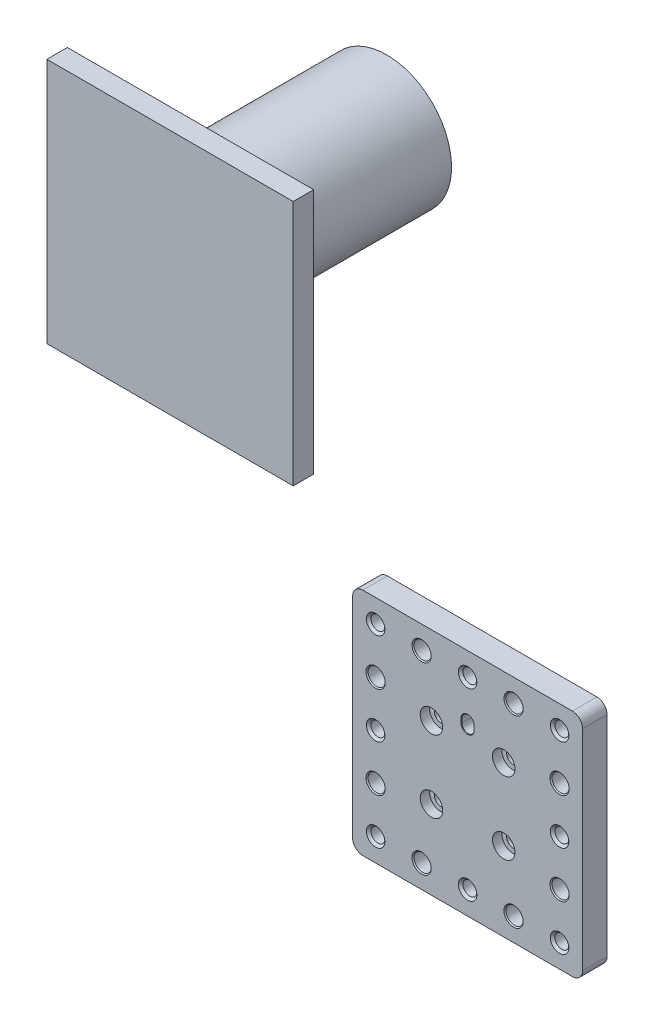
from build123d import *

# Parameters (mm, degrees)
SKETCH1_W                               = 112.5
SKETCH1_H                               = 112.5
BOSS_EXTRUDE1_DEPTH                     = 12
FILLET1_R                               = 5
SKETCH3_W                               = 31.7
SKETCH3_H                               = 4
CUT_EXTRUDE1_DEPTH                      = 81.449518333
CHAMFER3_SIZE                           = 0.25
CBORE_FOR_M6_HEX_HEAD_BOLT1_D           = 6.4
CBORE_FOR_M6_HEX_HEAD_BOLT1_CBORE_D     = 11
CBORE_FOR_M6_HEX_HEAD_BOLT1_CBORE_DEPTH = 4.6
F_6_8_6_8_DIAMETER_HOLE1_D              = 6.8
F_6_8_6_8_DIAMETER_HOLE2_D              = 6.8
CHAMFER1_SIZE                           = 1.125
CBORE_FOR_M8_HEX_HEAD_BOLT1_D           = 8.4
CBORE_FOR_M8_HEX_HEAD_BOLT1_CBORE_D     = 15
CBORE_FOR_M8_HEX_HEAD_BOLT1_CBORE_DEPTH = 5.6
CHAMFER2_SIZE                           = 0.5
SKETCH13_W                              = 120.5
SKETCH13_H                              = 120.5
BOSS_EXTRUDE5_DEPTH                     = 10
SKETCH20_R                              = 31.7
BOSS_EXTRUDE6_DEPTH                     = 100


with BuildPart() as part:
    # Sketch1 → Boss-Extrude1 (new body)
    with BuildSketch(Plane.XY.offset(12)):
        Rectangle(SKETCH1_W, SKETCH1_H)
    extrude(amount=-BOSS_EXTRUDE1_DEPTH)

    # Fillet1
    fillet1_edges = [part.edges().sort_by_distance(p)[0] for p in [
        (-56.25, 56.25, 6),
        (56.25, 56.25, 6),
        (56.25, -56.25, 6),
        (-56.25, -56.25, 6),
    ]]
    fillet(fillet1_edges, radius=FILLET1_R)

    # Sketch3 → Cut-Revolve1 (revolve, cut)
    with BuildSketch(Plane(origin=(0, 0, 0), x_dir=(1, 0, 0), z_dir=(0, 1, 0))):
        with Locations((-15.85, -2)):
            Rectangle(SKETCH3_W, SKETCH3_H)
    revolve(axis=Axis((0, 0, 4), (0, 0, -1)), mode=Mode.SUBTRACT)

    # Sketch2 → Cut-Extrude1 (cut, through all)
    with BuildSketch(Plane(origin=(0, 0, 0), x_dir=(-1, 0, 0), z_dir=(0, 0, -1))):
        with BuildLine():
            Line((3, 26), (3, 24))
            ThreePointArc((3, 24), (0, 21), (-3, 24))
            Line((-3, 24), (-3, 26))
            ThreePointArc((-3, 26), (0, 29), (3, 26))
        make_face()
    extrude(amount=-CUT_EXTRUDE1_DEPTH, mode=Mode.SUBTRACT)

    # Chamfer3
    chamfer3_edges = [part.edges().sort_by_distance(p)[0] for p in [
        (3, 25, 4),
        (0, 21, 4),
        (-3, 25, 4),
        (0, 29, 4),
        (0, 29, 12),
        (-3, 25, 12),
        (0, 21, 12),
        (3, 25, 12),
    ]]
    chamfer(chamfer3_edges, length=CHAMFER3_SIZE)

    # CBORE for M6 Hex Head Bolt1 (through all)
    with Locations(Plane.XY.offset(12)):
        with Locations((-17.67766953, -17.67766953), (17.67766953, -17.67766953), (17.67766953, 17.67766953), (-17.67766953, 17.67766953)):
            CounterBoreHole(CBORE_FOR_M6_HEX_HEAD_BOLT1_D / 2, CBORE_FOR_M6_HEX_HEAD_BOLT1_CBORE_D / 2, CBORE_FOR_M6_HEX_HEAD_BOLT1_CBORE_DEPTH)

    # Ø6.8 (6.8) Diameter Hole1 (through all)
    with Locations(Plane.XY.offset(12)):
        with Locations((-45, 0), (-45, 45), (0, -45), (45, -45), (-45, -45)):
            Hole(F_6_8_6_8_DIAMETER_HOLE1_D / 2)

    # Ø6.8 (6.8) Diameter Hole2 (through all)
    with Locations(Plane(origin=(0, 0, 0), x_dir=(-1, 0, 0), z_dir=(0, 0, -1))):
        with Locations((-45, 0), (0, 45), (-45, 45)):
            Hole(F_6_8_6_8_DIAMETER_HOLE2_D / 2)

    # Chamfer1
    chamfer1_edges = [part.edges().sort_by_distance(p)[0] for p in [
        (-41.6, -45, 12),
        (-41.6, -45, 0),
        (48.4, -45, 12),
        (48.4, -45, 0),
        (3.4, -45, 12),
        (3.4, -45, 0),
        (-41.6, 45, 12),
        (-41.6, 45, 0),
        (-41.6, 0, 12),
        (-41.6, 0, 0),
        (41.6, 45, 0),
        (41.6, 45, 12),
        (-3.4, 45, 0),
        (-3.4, 45, 12),
        (41.6, 0, 0),
        (41.6, 0, 12),
    ]]
    chamfer(chamfer1_edges, length=CHAMFER1_SIZE)

    # CBORE for M8 Hex Head Bolt1 (through all)
    with Locations(Plane(origin=(0, 0, 0), x_dir=(-1, 0, 0), z_dir=(0, 0, -1))):
        with Locations((-45, 22.5), (-22.5, 45), (45, 22.5), (22.5, 45), (45, -22.5), (22.5, -45), (-45, -22.5), (-22.5, -45)):
            CounterBoreHole(CBORE_FOR_M8_HEX_HEAD_BOLT1_D / 2, CBORE_FOR_M8_HEX_HEAD_BOLT1_CBORE_D / 2, CBORE_FOR_M8_HEX_HEAD_BOLT1_CBORE_DEPTH)

    # Chamfer2
    chamfer2_edges = [part.edges().sort_by_distance(p)[0] for p in [
        (18.3, -45, 12),
        (40.8, -22.5, 12),
        (-26.7, -45, 12),
        (-49.2, -22.5, 12),
        (-26.7, 45, 12),
        (-49.2, 22.5, 12),
        (18.3, 45, 12),
        (40.8, 22.5, 12),
    ]]
    chamfer(chamfer2_edges, length=CHAMFER2_SIZE)


with BuildPart() as body_2:
    # Sketch13 → Boss-Extrude5 (new body)
    with BuildSketch(Plane(origin=(0, 0, 4), x_dir=(-1, 0, 0), z_dir=(0, 0, -1))):
        with Locations((153.559377031, 135.617578419)):
            Rectangle(SKETCH13_W, SKETCH13_H)
    extrude(amount=BOSS_EXTRUDE5_DEPTH)

    # Sketch20 → Boss-Extrude6 (add)
    with BuildSketch(Plane(origin=(0, 0, -6), x_dir=(-1, 0, 0), z_dir=(0, 0, -1))):
        with Locations((157.559377031, 139.175827087)):
            Circle(SKETCH20_R)
    extrude(amount=BOSS_EXTRUDE6_DEPTH)


solid = Compound([part.part, body_2.part])
